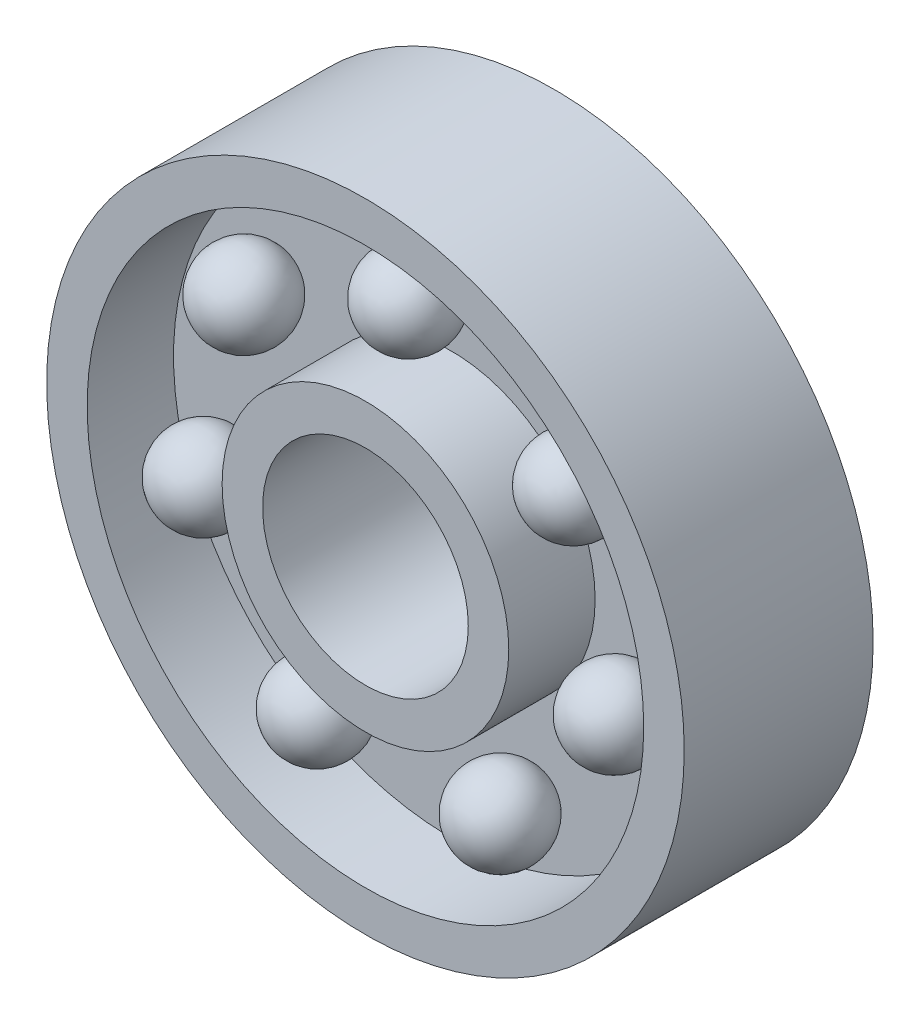
from build123d import *

# Parameters (mm, degrees)
CIRPATTERN17_COUNT = 7
SKETCH3_W          = 2.9
SKETCH3_H          = 5


with BuildPart() as part:
    # Sketch1 → Revolve1 (revolve)
    with BuildSketch(Plane(origin=(0, 0, 0), x_dir=(0, 0, -1), z_dir=(1, 0, 0)), mode=Mode.PRIVATE) as revolve1_sk:
        Polygon((0, 0), (-7, 0), (-7, 1.5), (-3.8, 1.5), (-3.8, 6.5), (-7, 6.5), (-7, 8), (0, 8), (0, 6.5), (-3.2, 6.5), (-3.2, 1.5), (0, 1.5), align=None)
    revolve(revolve1_sk.sketch.rotate(Axis((0, -3.81, 8.756759189), (0, 0, -1)), 90), axis=Axis((0, -3.81, 8.756759189), (0, 0, -1)))


with BuildPart() as body_2:
    # Sketch2 → Revolve3 (revolve)
    with BuildSketch(Plane(origin=(0, 0, 0), x_dir=(0, 0, -1), z_dir=(1, 0, 0))):
        with BuildLine():
            Line((-3.8, 4), (-7, 4))
            ThreePointArc((-7, 4), (-5.4, 5.6), (-3.8, 4))
        make_face()
    revolve(axis=Axis((0, 4, 8.125819728), (0, 0, -1)))


with BuildPart() as cirpattern17_1:
    # CirPattern17: pattern copy
    add(body_2.part.rotate(Axis((0, -3.81, 0), (0, 0, 1)), 1 * 360 / CIRPATTERN17_COUNT))


with BuildPart() as cirpattern17_2:
    # CirPattern17: pattern copy
    add(body_2.part.rotate(Axis((0, -3.81, 0), (0, 0, 1)), 2 * 360 / CIRPATTERN17_COUNT))


with BuildPart() as cirpattern17_3:
    # CirPattern17: pattern copy
    add(body_2.part.rotate(Axis((0, -3.81, 0), (0, 0, 1)), 3 * 360 / CIRPATTERN17_COUNT))


with BuildPart() as cirpattern17_4:
    # CirPattern17: pattern copy
    add(body_2.part.rotate(Axis((0, -3.81, 0), (0, 0, 1)), 4 * 360 / CIRPATTERN17_COUNT))


with BuildPart() as cirpattern17_5:
    # CirPattern17: pattern copy
    add(body_2.part.rotate(Axis((0, -3.81, 0), (0, 0, 1)), 5 * 360 / CIRPATTERN17_COUNT))


with BuildPart() as cirpattern17_6:
    # CirPattern17: pattern copy
    add(body_2.part.rotate(Axis((0, -3.81, 0), (0, 0, 1)), 6 * 360 / CIRPATTERN17_COUNT))


with BuildPart() as body_9:
    # Sketch3 → Revolve4 (revolve)
    with BuildSketch(Plane(origin=(0, 0, 0), x_dir=(0, 0, -1), z_dir=(1, 0, 0)), mode=Mode.PRIVATE) as revolve4_sk:
        with Locations((-1.75, 4)):
            Rectangle(SKETCH3_W, SKETCH3_H)
    revolve(revolve4_sk.sketch.rotate(Axis((0, -3.81, 8.756759189), (0, 0, -1)), 90), axis=Axis((0, -3.81, 8.756759189), (0, 0, -1)))


solid = Compound([part.part, body_2.part, cirpattern17_1.part, cirpattern17_2.part, cirpattern17_3.part, cirpattern17_4.part, cirpattern17_5.part, cirpattern17_6.part, body_9.part])
